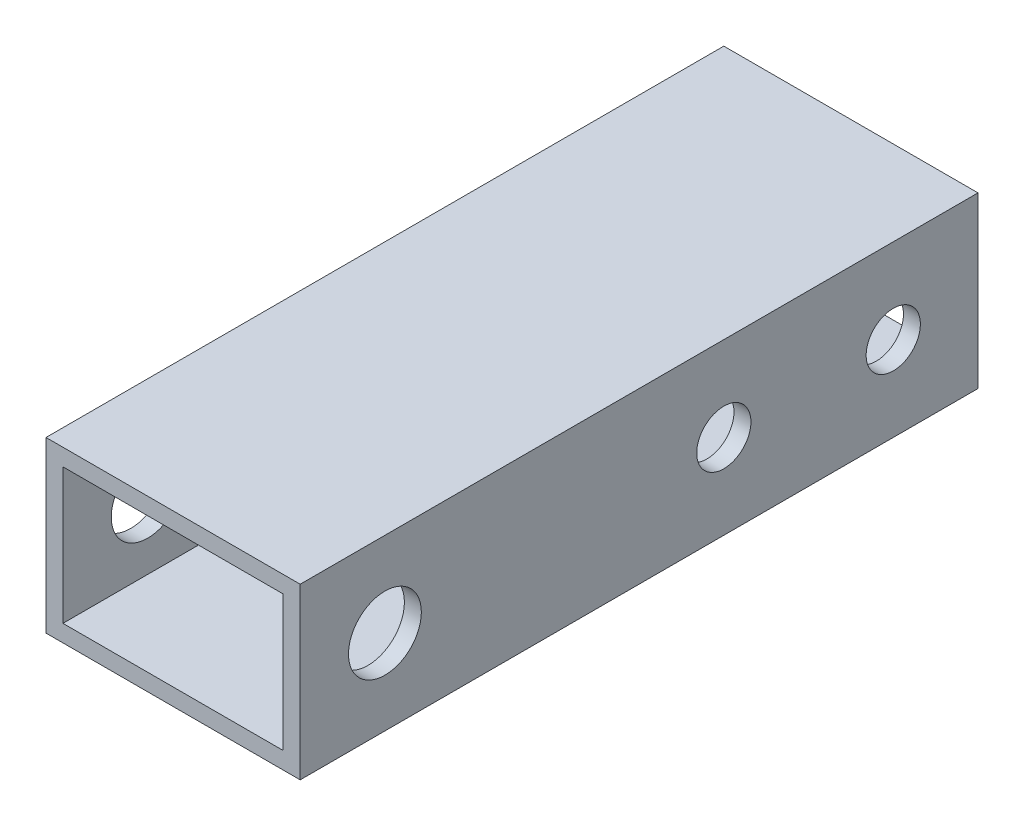
from build123d import *

# Parameters (mm, degrees)
SKETCH_1_W          = 15
SKETCH_1_H          = 10
SKETCH_1_W_2        = 13
SKETCH_1_H_2        = 8
EXTRUDE_1_DEPTH     = 40
CUT_EXTRUDE_1_REACH = 45.875
SKETCH_2_R          = 1.6
SKETCH_2_R_2        = 2.15


with BuildPart() as part:
    # ｽｹｯﾁ1 → 押し出し-薄板1 (new body)
    with BuildSketch(Plane.XY):
        with Locations((7.5, 5)):
            Rectangle(SKETCH_1_W, SKETCH_1_H)
        with Locations((7.5, 5)):
            Rectangle(SKETCH_1_W_2, SKETCH_1_H_2, mode=Mode.SUBTRACT)
    extrude(amount=EXTRUDE_1_DEPTH)

    # ｶｯﾄ - 押し出し1: up to this face of the body (flat: up to its plane)
    cut_extrude_1_end = Plane(part.part.faces().sort_by_distance((0, 5, 20))[0])
    # ｽｹｯﾁ2 → ｶｯﾄ - 押し出し1 (cut, up to the picked face)
    with BuildSketch(Plane(origin=(15, 0, 0), x_dir=(0, 0, -1), z_dir=(1, 0, 0)), mode=Mode.PRIVATE) as cut_extrude_1_sk1:
        with Locations((-5, 5)):
            Circle(SKETCH_2_R)
    cut_extrude_1_tool1 = split(extrude(cut_extrude_1_sk1.sketch, amount=-CUT_EXTRUDE_1_REACH, mode=Mode.PRIVATE), bisect_by=cut_extrude_1_end, keep=Keep.BOTH, mode=Mode.PRIVATE)
    # ｽｹｯﾁ2 → ｶｯﾄ - 押し出し1 (cut, up to the picked face)
    with BuildSketch(Plane(origin=(15, 0, 0), x_dir=(0, 0, -1), z_dir=(1, 0, 0)), mode=Mode.PRIVATE) as cut_extrude_1_sk2:
        with Locations((-15, 5)):
            Circle(SKETCH_2_R)
    cut_extrude_1_tool2 = split(extrude(cut_extrude_1_sk2.sketch, amount=-CUT_EXTRUDE_1_REACH, mode=Mode.PRIVATE), bisect_by=cut_extrude_1_end, keep=Keep.BOTH, mode=Mode.PRIVATE)
    # ｽｹｯﾁ2 → ｶｯﾄ - 押し出し1 (cut, up to the picked face)
    with BuildSketch(Plane(origin=(15, 0, 0), x_dir=(0, 0, -1), z_dir=(1, 0, 0)), mode=Mode.PRIVATE) as cut_extrude_1_sk3:
        with Locations((-35, 5)):
            Circle(SKETCH_2_R_2)
    cut_extrude_1_tool3 = split(extrude(cut_extrude_1_sk3.sketch, amount=-CUT_EXTRUDE_1_REACH, mode=Mode.PRIVATE), bisect_by=cut_extrude_1_end, keep=Keep.BOTH, mode=Mode.PRIVATE)
    add(cut_extrude_1_tool1.solids().sort_by(Axis((15, 5, 5), (-1, 0, 0)))[0], mode=Mode.SUBTRACT)
    add(cut_extrude_1_tool2.solids().sort_by(Axis((15, 5, 15), (-1, 0, 0)))[0], mode=Mode.SUBTRACT)
    add(cut_extrude_1_tool3.solids().sort_by(Axis((15, 5, 35), (-1, 0, 0)))[0], mode=Mode.SUBTRACT)


solid = part.part
